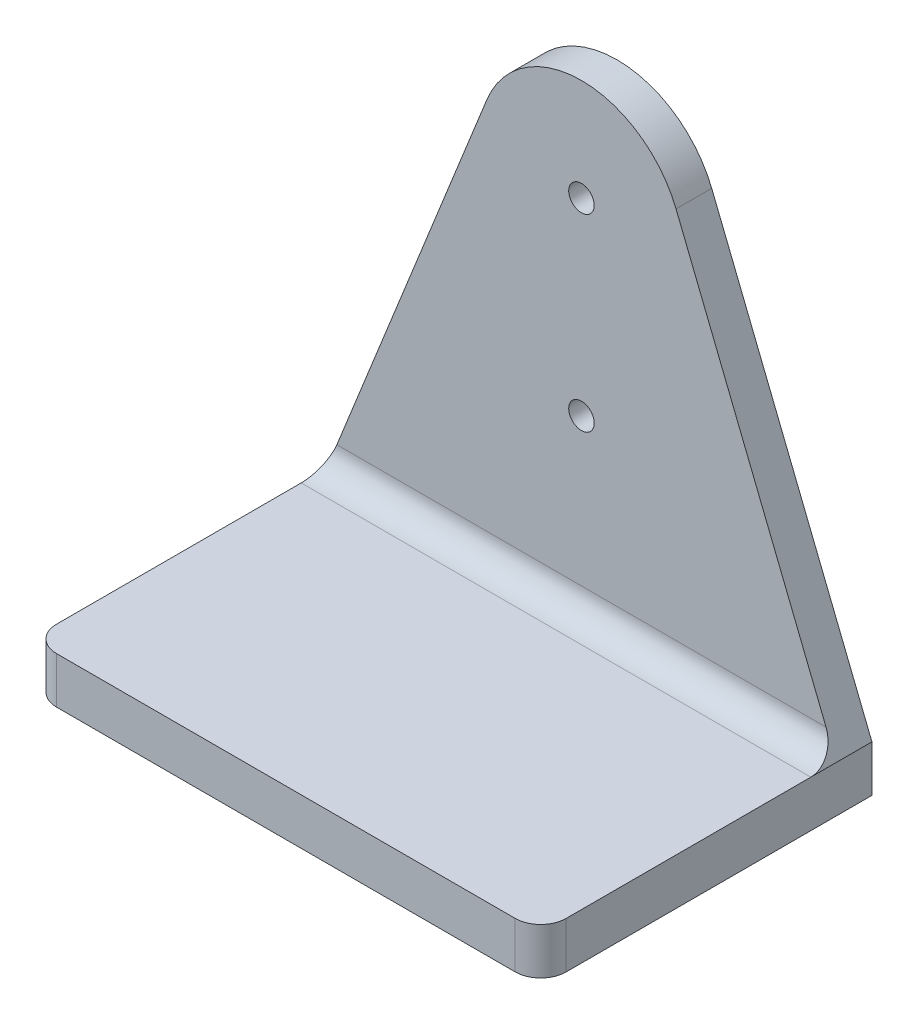
from build123d import *

# Parameters (mm, degrees)
SKETCH1_W                 = 100
SKETCH1_H                 = 65
EXTRUDE1_DEPTH            = 9.1
EXTRUDE2_DEPTH            = 7
M6X1_0_TAPPED_HOLE2_D     = 5
M6X1_0_TAPPED_HOLE2_DEPTH = 15
M6X1_0_TAPPED_HOLE2_TIP   = 1.502151548
FILLET1_R                 = 5
FILLET2_R                 = 5


with BuildPart() as part:
    # Sketch1 → Extrude1 (new body)
    with BuildSketch(Plane(origin=(0, 0, 0), x_dir=(1, 0, 0), z_dir=(0, 1, 0))):
        Rectangle(SKETCH1_W, SKETCH1_H)
    extrude(amount=EXTRUDE1_DEPTH)

    # Sketch3 → Extrude2 (add)
    with BuildSketch(Plane(origin=(0, 0, -32.5), x_dir=(-1, 0, 0), z_dir=(0, 0, -1))):
        with BuildLine():
            Line((-50, 9.1), (-18.561406243, 87.448100313))
            ThreePointArc((-18.561406243, 87.448100313), (0, 100), (18.561406243, 87.448100313))
            Line((18.561406243, 87.448100313), (50, 9.1))
            Line((50, 9.1), (-50, 9.1))
        make_face()
    extrude(amount=-EXTRUDE2_DEPTH)

    # M6x1.0 Tapped Hole2
    with Locations(Plane.XY.offset(-25.5)):
        with Locations((0, 80), (0, 43)):
            Hole(M6X1_0_TAPPED_HOLE2_D / 2, depth=M6X1_0_TAPPED_HOLE2_DEPTH)
            with Locations((0, 0, -(M6X1_0_TAPPED_HOLE2_DEPTH + M6X1_0_TAPPED_HOLE2_TIP / 2))):  # 118° drill point
                Cone(0, M6X1_0_TAPPED_HOLE2_D / 2, M6X1_0_TAPPED_HOLE2_TIP, mode=Mode.SUBTRACT)

    # Fillet1
    fillet1_edges = [part.edges().sort_by_distance(p)[0] for p in [
        (0, 9.1, -25.5),
    ]]
    fillet(fillet1_edges, radius=FILLET1_R)

    # Fillet2
    fillet2_edges = [part.edges().sort_by_distance(p)[0] for p in [
        (-50, 4.55, 32.5),
        (50, 4.55, 32.5),
    ]]
    fillet(fillet2_edges, radius=FILLET2_R)


solid = part.part
